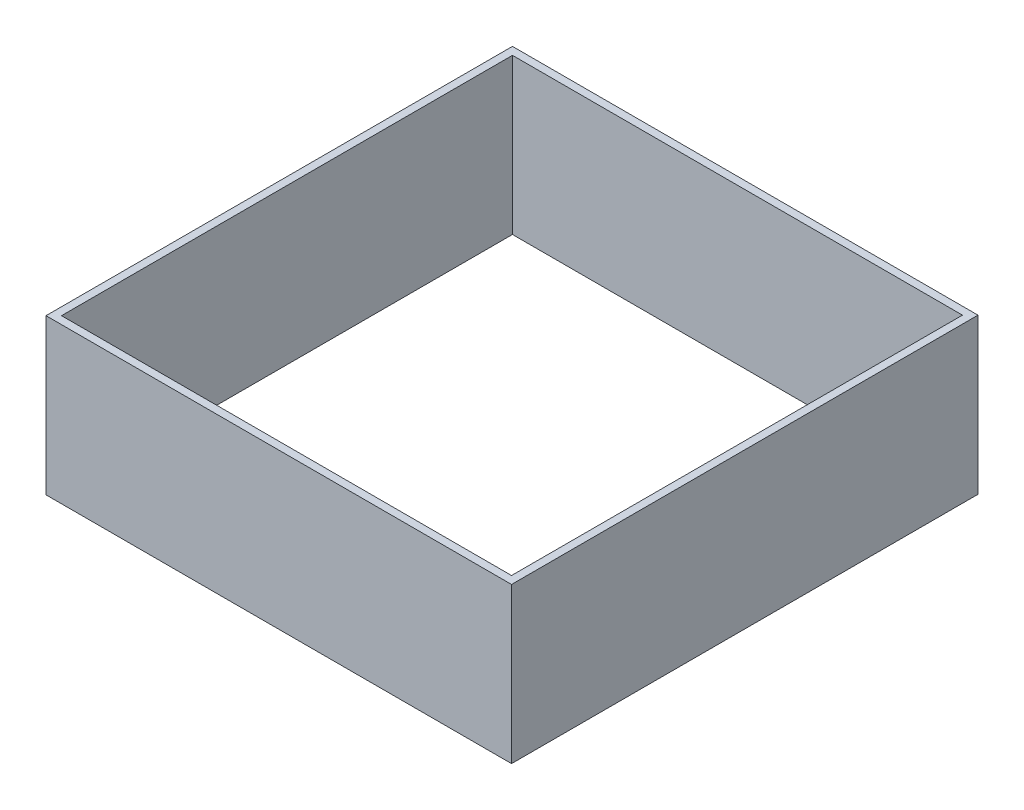
from build123d import *

# Parameters (mm, degrees)
CROQUIS1_W                   = 40
CROQUIS1_H                   = 40
SALIENTE_EXTRUIR1_DEPTH      = 0.3
SALIENTE_EXTRUIR2_DEPTH      = 10
SALIENTE_EXTRUIR2_DEPTH_BACK = 10
CROQUIS2_R                   = 2.5
CORTAR_EXTRUIR1_DEPTH        = 2.5
CORTAR_EXTRUIR1_DEPTH_BACK   = 2.5
CROQUIS3_W                   = 14.056155144
CROQUIS3_H                   = 12
CROQUIS4_W                   = 300
CROQUIS4_H                   = 100
SALIENTE_EXTRUIR3_DEPTH      = 5
CROQUIS5_W                   = 300
CROQUIS5_H                   = 100
SALIENTE_EXTRUIR4_DEPTH      = 5


with BuildPart() as part:
    # Croquis1 → Saliente-Extruir1 (new body)
    with BuildSketch(Plane.XY):
        Rectangle(CROQUIS1_W, CROQUIS1_H)
    extrude(amount=SALIENTE_EXTRUIR1_DEPTH)

    # Croquis2 → Saliente-Extruir2 (add, two sides: drawn at the far end of the back side and taken through both)
    with BuildSketch(Plane(origin=(0, 0, 0), x_dir=(1, 0, 0), z_dir=(0, 1, 0)).offset(-SALIENTE_EXTRUIR2_DEPTH_BACK)):
        with BuildLine():
            Line((-5, 10), (-5, 0))
            Line((-5, 0), (5, 0))
            Line((5, 0), (5, 10))
            ThreePointArc((5, 10), (0, 15), (-5, 10))
        make_face()
        with Locations(Location((0, 10, 0), (0, 0, 270))):
            Circle(CROQUIS2_R, mode=Mode.SUBTRACT)
    extrude(amount=SALIENTE_EXTRUIR2_DEPTH + SALIENTE_EXTRUIR2_DEPTH_BACK)

    # Croquis3 → Cortar-Extruir1 (cut, two sides: drawn at the far end of the back side and taken through both)
    with BuildSketch(Plane(origin=(0, 0, 0), x_dir=(1, 0, 0), z_dir=(0, 1, 0)).offset(-CORTAR_EXTRUIR1_DEPTH_BACK)):
        with Locations((0, 10)):
            Rectangle(CROQUIS3_W, CROQUIS3_H)
    extrude(amount=CORTAR_EXTRUIR1_DEPTH + CORTAR_EXTRUIR1_DEPTH_BACK, mode=Mode.SUBTRACT)

    # Croquis4 → Saliente-Extruir3 (add)
    with BuildSketch(Plane.XY.offset(0.3)):
        Rectangle(CROQUIS4_W, CROQUIS4_H)
    saliente_extruir3 = extrude(amount=SALIENTE_EXTRUIR3_DEPTH)

    # Croquis5 → Saliente-Extruir4 (add)
    with BuildSketch(Plane(origin=(150, 0, 0), x_dir=(0, 0, -1), z_dir=(1, 0, 0))):
        with Locations((144.7, 0)):
            Rectangle(CROQUIS5_W, CROQUIS5_H)
    saliente_extruir4 = extrude(amount=-SALIENTE_EXTRUIR4_DEPTH)

    # Simetría2: Saliente-Extruir4 across plane
    add(saliente_extruir4.mirror(Plane(origin=(0, 0, 0), x_dir=(0, 0, 1), z_dir=(1, 0, 0))))

    # Simetría3: Saliente-Extruir3 across plane
    add(saliente_extruir3.mirror(Plane.XY.offset(-145)))


solid = part.part
